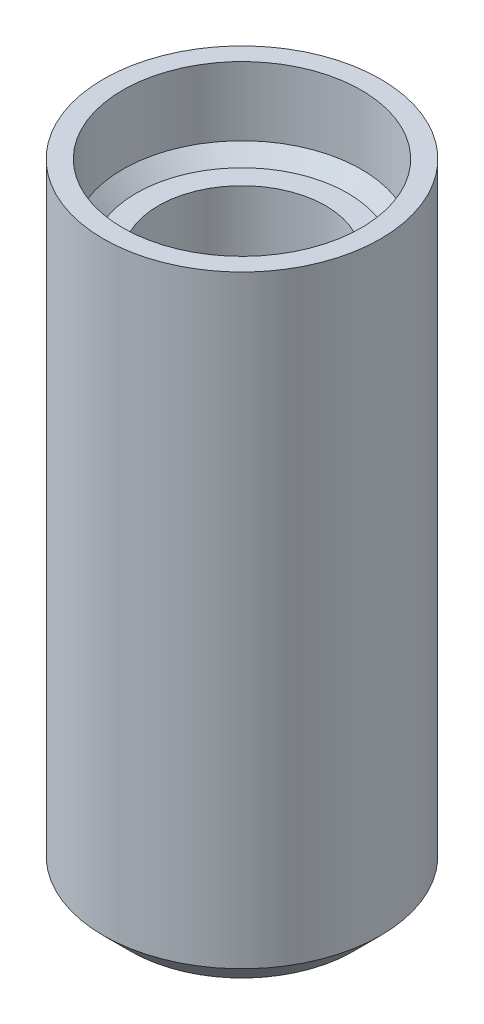
from build123d import *

# Parameters (mm, degrees)
SKETCH1_R           = 5.05
BOSS_EXTRUDE1_DEPTH = 20
SKETCH2_R           = 5.05
BOSS_EXTRUDE2_DEPTH = 2
SKETCH4_R           = 5.05
SKETCH4_R_2         = 4.35
BOSS_EXTRUDE3_DEPTH = 3
CHAMFER1_SIZE       = 1
CHAMFER2_SIZE       = 0.5
CUT_EXTRUDE1_DEPTH  = 0.4
BOSS_EXTRUDE4_DEPTH = 0.4


with BuildPart() as part:
    # Sketch1 → Boss-Extrude1 (new body)
    with BuildSketch(Plane(origin=(0, 0, 0), x_dir=(1, 0, 0), z_dir=(0, 1, 0))):
        Circle(SKETCH1_R)
        with BuildLine():
            Line((2.565151068, -1.65), (-2.565151068, -1.65))
            ThreePointArc((-2.565151068, -1.65), (0, 3.05), (2.565151068, -1.65))
        make_face(mode=Mode.SUBTRACT)
    extrude(amount=BOSS_EXTRUDE1_DEPTH)

    # Sketch2 → Boss-Extrude2 (add)
    with BuildSketch(Plane.XZ):
        Circle(SKETCH2_R)
    extrude(amount=-BOSS_EXTRUDE2_DEPTH)

    # Sketch4 → Boss-Extrude3 (add)
    with BuildSketch(Plane(origin=(0, 20, 0), x_dir=(1, 0, 0), z_dir=(0, 1, 0))):
        Circle(SKETCH4_R)
        Circle(SKETCH4_R_2, mode=Mode.SUBTRACT)
    extrude(amount=BOSS_EXTRUDE3_DEPTH)

    # Chamfer1
    chamfer1_edges = [part.edges().sort_by_distance(p)[0] for p in [
        (-5.05, 0, 0),
    ]]
    chamfer(chamfer1_edges, length=CHAMFER1_SIZE)

    # Chamfer2
    chamfer2_edges = [part.edges().sort_by_distance(p)[0] for p in [
        (-4.35, 20, 0),
    ]]
    chamfer(chamfer2_edges, length=CHAMFER2_SIZE)

    # Sketch5 → Cut-Extrude1 (cut)
    with BuildSketch(Plane.XZ):
        with BuildLine():
            add(Edge.make_bspline(
                [(1.631941732, -0.755044451), (1.631711834, -0.781729287), (1.631279836, -0.83187248), (1.624169455, -0.902071791), (1.61354776, -0.962360211), (1.59926486, -1.012775634), (1.580315281, -1.052346406), (1.558755386, -1.082359327), (1.53114696, -1.099834777), (1.51147004, -1.102663084), (1.501946373, -1.10403199)],
                knots=[0, 0, 0, 0, 1.593603655, 2.994523807, 4.209267046, 5.248799156, 6.112701127, 6.821812225, 7.429754874, 8, 8, 8, 8], degree=3))
            Line((1.501946373, -1.10403199), (1.119960012, -1.10403199))
            Line((1.119960012, -1.10403199), (1.119960012, -1.869004677))
            add(Edge.make_bspline(
                [(1.119960012, -1.869004677), (1.1190276, -1.879514942), (1.11717803, -1.900363512), (1.100781449, -1.929606387), (1.070457056, -1.952360817), (1.02775066, -1.970719903), (0.970204741, -1.983922011), (0.897251108, -1.993498632), (0.805057261, -1.999216421), (0.736982299, -1.999719258), (0.698975043, -2)],
                knots=[0, 0, 0, 0, 0.525703783, 1.042806514, 1.625893093, 2.39765282, 3.364048858, 4.581030562, 6.091138931, 8, 8, 8, 8], degree=3))
            add(Edge.make_bspline(
                [(0.698975043, -2), (0.662638483, -1.999680966), (0.596237721, -1.99909797), (0.505670365, -1.993549267), (0.432822332, -1.9837837), (0.375587998, -1.97121932), (0.334351205, -1.952054514), (0.304709495, -1.929821711), (0.291231595, -1.899809452), (0.289087047, -1.87943166), (0.287989717, -1.869004677)],
                knots=[0, 0, 0, 0, 1.858233089, 3.39570102, 4.63473153, 5.61863636, 6.373449397, 6.953985978, 7.464771718, 8, 8, 8, 8], degree=3))
            Line((0.287989717, -1.869004677), (0.287989717, -1.10403199))
            Line((0.287989717, -1.10403199), (-1.430948908, -1.10403199))
            add(Edge.make_bspline(
                [(-1.430948908, -1.10403199), (-1.446295186, -1.103412765), (-1.475615652, -1.102229679), (-1.518140665, -1.094427216), (-1.555773037, -1.073109541), (-1.58616843, -1.036199626), (-1.607165622, -0.982245201), (-1.622758573, -0.910508327), (-1.630623202, -0.816535459), (-1.631467974, -0.746386513), (-1.631941732, -0.707046165)],
                knots=[0, 0, 0, 0, 0.721830018, 1.379122135, 2.010344175, 2.710096748, 3.579823955, 4.704200885, 6.15167733, 8, 8, 8, 8], degree=3))
            add(Edge.make_bspline(
                [(-1.631941732, -0.707046165), (-1.631855992, -0.673710867), (-1.63169644, -0.611677654), (-1.627859181, -0.524581605), (-1.620675539, -0.448197107), (-1.61140423, -0.379463469), (-1.595930544, -0.316289463), (-1.575663182, -0.255996569), (-1.54871653, -0.196367872), (-1.528447294, -0.156646299), (-1.517945802, -0.136066551)],
                knots=[0, 0, 0, 0, 1.355920511, 2.523214427, 3.544523483, 4.476419512, 5.341300522, 6.18596521, 7.060148557, 8, 8, 8, 8], degree=3))
            Line((-1.517945802, -0.136066551), (-0.125995501, 2.234848795))
            add(Edge.make_bspline(
                [(-0.125995501, 2.234848795), (-0.118826649, 2.244678179), (-0.103261763, 2.266019564), (-0.065190235, 2.290144018), (-0.013803763, 2.309357894), (0.053587112, 2.326305114), (0.138951007, 2.338732104), (0.244225735, 2.345752456), (0.371271055, 2.350790371), (0.46364318, 2.351472752), (0.513981648, 2.351844618)],
                knots=[0, 0, 0, 0, 0.433899394, 0.942074677, 1.586920186, 2.403031765, 3.43269784, 4.681722832, 6.191694851, 8, 8, 8, 8], degree=3))
            add(Edge.make_bspline(
                [(0.513981648, 2.351844618), (0.565330252, 2.351666334), (0.659751295, 2.351338501), (0.789464206, 2.344069356), (0.895633515, 2.33449455), (0.978826037, 2.318529599), (1.042071686, 2.300153794), (1.085226569, 2.274596454), (1.115197825, 2.244496698), (1.118421934, 2.219685887), (1.119960012, 2.207849759)],
                knots=[0, 0, 0, 0, 1.870363282, 3.439268813, 4.733465961, 5.748069416, 6.52766601, 7.110840176, 7.575821608, 8, 8, 8, 8], degree=3))
            Line((1.119960012, 2.207849759), (1.119960012, -0.400057126))
            Line((1.119960012, -0.400057126), (1.501946373, -0.400057126))
            add(Edge.make_bspline(
                [(1.501946373, -0.400057126), (1.510823484, -0.401063547), (1.529189779, -0.403145781), (1.554586269, -0.420271717), (1.576158449, -0.44744336), (1.596465382, -0.484491265), (1.613298175, -0.533336076), (1.624583151, -0.595271866), (1.631275777, -0.67056467), (1.631707747, -0.725362278), (1.631941732, -0.755044451)],
                knots=[0, 0, 0, 0, 0.51983486, 1.075512151, 1.744218405, 2.552791553, 3.552578929, 4.773200779, 6.252142485, 8, 8, 8, 8], degree=3))
        make_face()
        Polygon((0.287989717, 1.583872038), (0.280989967, 1.583872038), (-0.927966867, -0.400057126), (0.287989717, -0.400057126), align=None, mode=Mode.SUBTRACT)
    extrude(amount=-CUT_EXTRUDE1_DEPTH, mode=Mode.SUBTRACT)


with BuildPart() as body_2:
    # Sketch5<2> → Boss-Extrude4 (new body)
    with BuildSketch(Plane.XZ):
        with BuildLine():
            add(Edge.make_bspline(
                [(1.631941732, -0.755044451), (1.631711834, -0.781729287), (1.631279836, -0.83187248), (1.624169455, -0.902071791), (1.61354776, -0.962360211), (1.59926486, -1.012775634), (1.580315281, -1.052346406), (1.558755386, -1.082359327), (1.53114696, -1.099834777), (1.51147004, -1.102663084), (1.501946373, -1.10403199)],
                knots=[0, 0, 0, 0, 1.593603655, 2.994523807, 4.209267046, 5.248799156, 6.112701127, 6.821812225, 7.429754874, 8, 8, 8, 8], degree=3))
            Line((1.501946373, -1.10403199), (1.119960012, -1.10403199))
            Line((1.119960012, -1.10403199), (1.119960012, -1.869004677))
            add(Edge.make_bspline(
                [(1.119960012, -1.869004677), (1.1190276, -1.879514942), (1.11717803, -1.900363512), (1.100781449, -1.929606387), (1.070457056, -1.952360817), (1.02775066, -1.970719903), (0.970204741, -1.983922011), (0.897251108, -1.993498632), (0.805057261, -1.999216421), (0.736982299, -1.999719258), (0.698975043, -2)],
                knots=[0, 0, 0, 0, 0.525703783, 1.042806514, 1.625893093, 2.39765282, 3.364048858, 4.581030562, 6.091138931, 8, 8, 8, 8], degree=3))
            add(Edge.make_bspline(
                [(0.698975043, -2), (0.662638483, -1.999680966), (0.596237721, -1.99909797), (0.505670365, -1.993549267), (0.432822332, -1.9837837), (0.375587998, -1.97121932), (0.334351205, -1.952054514), (0.304709495, -1.929821711), (0.291231595, -1.899809452), (0.289087047, -1.87943166), (0.287989717, -1.869004677)],
                knots=[0, 0, 0, 0, 1.858233089, 3.39570102, 4.63473153, 5.61863636, 6.373449397, 6.953985978, 7.464771718, 8, 8, 8, 8], degree=3))
            Line((0.287989717, -1.869004677), (0.287989717, -1.10403199))
            Line((0.287989717, -1.10403199), (-1.430948908, -1.10403199))
            add(Edge.make_bspline(
                [(-1.430948908, -1.10403199), (-1.446295186, -1.103412765), (-1.475615652, -1.102229679), (-1.518140665, -1.094427216), (-1.555773037, -1.073109541), (-1.58616843, -1.036199626), (-1.607165622, -0.982245201), (-1.622758573, -0.910508327), (-1.630623202, -0.816535459), (-1.631467974, -0.746386513), (-1.631941732, -0.707046165)],
                knots=[0, 0, 0, 0, 0.721830018, 1.379122135, 2.010344175, 2.710096748, 3.579823955, 4.704200885, 6.15167733, 8, 8, 8, 8], degree=3))
            add(Edge.make_bspline(
                [(-1.631941732, -0.707046165), (-1.631855992, -0.673710867), (-1.63169644, -0.611677654), (-1.627859181, -0.524581605), (-1.620675539, -0.448197107), (-1.61140423, -0.379463469), (-1.595930544, -0.316289463), (-1.575663182, -0.255996569), (-1.54871653, -0.196367872), (-1.528447294, -0.156646299), (-1.517945802, -0.136066551)],
                knots=[0, 0, 0, 0, 1.355920511, 2.523214427, 3.544523483, 4.476419512, 5.341300522, 6.18596521, 7.060148557, 8, 8, 8, 8], degree=3))
            Line((-1.517945802, -0.136066551), (-0.125995501, 2.234848795))
            add(Edge.make_bspline(
                [(-0.125995501, 2.234848795), (-0.118826649, 2.244678179), (-0.103261763, 2.266019564), (-0.065190235, 2.290144018), (-0.013803763, 2.309357894), (0.053587112, 2.326305114), (0.138951007, 2.338732104), (0.244225735, 2.345752456), (0.371271055, 2.350790371), (0.46364318, 2.351472752), (0.513981648, 2.351844618)],
                knots=[0, 0, 0, 0, 0.433899394, 0.942074677, 1.586920186, 2.403031765, 3.43269784, 4.681722832, 6.191694851, 8, 8, 8, 8], degree=3))
            add(Edge.make_bspline(
                [(0.513981648, 2.351844618), (0.565330252, 2.351666334), (0.659751295, 2.351338501), (0.789464206, 2.344069356), (0.895633515, 2.33449455), (0.978826037, 2.318529599), (1.042071686, 2.300153794), (1.085226569, 2.274596454), (1.115197825, 2.244496698), (1.118421934, 2.219685887), (1.119960012, 2.207849759)],
                knots=[0, 0, 0, 0, 1.870363282, 3.439268813, 4.733465961, 5.748069416, 6.52766601, 7.110840176, 7.575821608, 8, 8, 8, 8], degree=3))
            Line((1.119960012, 2.207849759), (1.119960012, -0.400057126))
            Line((1.119960012, -0.400057126), (1.501946373, -0.400057126))
            add(Edge.make_bspline(
                [(1.501946373, -0.400057126), (1.510823484, -0.401063547), (1.529189779, -0.403145781), (1.554586269, -0.420271717), (1.576158449, -0.44744336), (1.596465382, -0.484491265), (1.613298175, -0.533336076), (1.624583151, -0.595271866), (1.631275777, -0.67056467), (1.631707747, -0.725362278), (1.631941732, -0.755044451)],
                knots=[0, 0, 0, 0, 0.51983486, 1.075512151, 1.744218405, 2.552791553, 3.552578929, 4.773200779, 6.252142485, 8, 8, 8, 8], degree=3))
        make_face()
        Polygon((0.287989717, 1.583872038), (0.280989967, 1.583872038), (-0.927966867, -0.400057126), (0.287989717, -0.400057126), align=None, mode=Mode.SUBTRACT)
    extrude(amount=-BOSS_EXTRUDE4_DEPTH)


solid = Compound([part.part, body_2.part])
